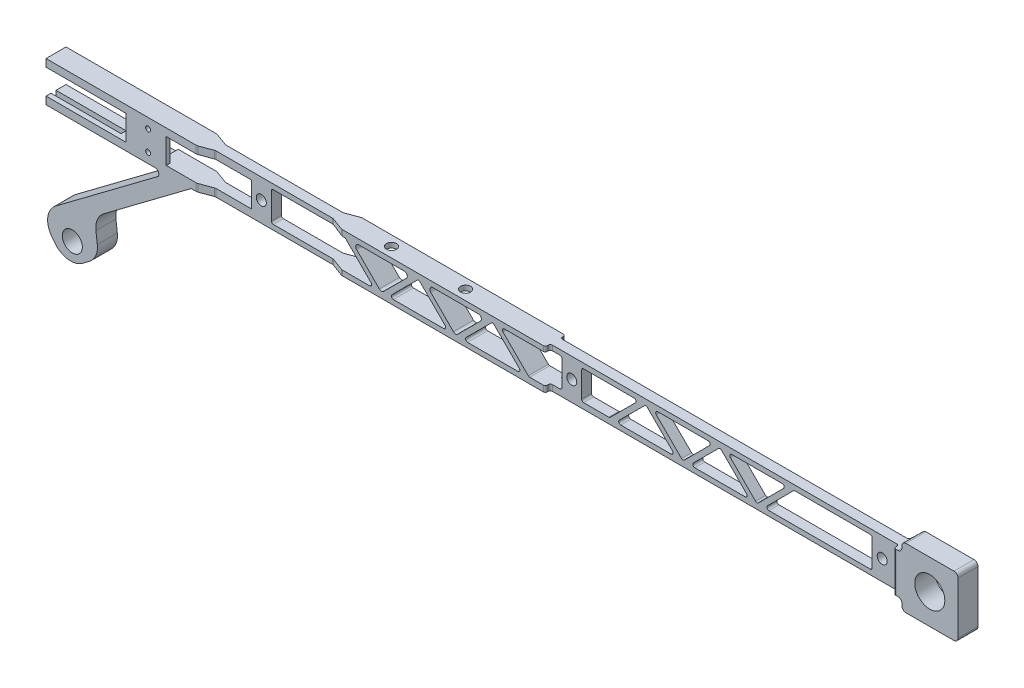
from build123d import *

# Parameters (mm, degrees)
BOSS_EXTRUDE1_DEPTH             = 12.7
CUT_EXTRUDE1_DEPTH              = 12.7
LPATTERN1_COUNT                 = 7
LPATTERN1_PITCH                 = 46.99
CUT_EXTRUDE2_DEPTH              = 12.7
LPATTERN2_COUNT                 = 8
LPATTERN2_PITCH                 = 46.99
CUT_EXTRUDE13_DEPTH             = 12.7
LPATTERN4_COUNT                 = 2
LPATTERN4_PITCH                 = 46.99
SKETCH15_W                      = 50.8
SKETCH15_H                      = 15.875
CUT_EXTRUDE6_DEPTH              = 573.205120564
SKETCH16_W                      = 3.175
SKETCH16_H                      = 22.225
CUT_EXTRUDE7_DEPTH              = 44.45
CUT_EXTRUDE8_DEPTH              = 10.16
SKETCH18_W                      = 50.8
SKETCH18_H                      = 15.875
CUT_EXTRUDE9_DEPTH              = 2.54
F_1_8_0_125_DIAMETER_HOLE1_D    = 3.175
CUT_EXTRUDE14_DEPTH             = 12.7
CUT_EXTRUDE15_START             = -12.7
CUT_EXTRUDE15_DEPTH             = 12.7
BOSS_EXTRUDE3_DEPTH             = 12.7
BOSS_EXTRUDE4_DEPTH             = 12.7
CUT_EXTRUDE10_DEPTH             = 12.7
SKETCH28_R                      = 6.35
BOSS_EXTRUDE5_DEPTH             = 12.7
CUT_EXTRUDE11_DEPTH             = 12.7
FILLET1_R                       = 12.7
F_1_4_0_25_DIAMETER_HOLE1_D     = 6.35
F_1_4_0_25_DIAMETER_HOLE2_D     = 6.35
F_1_4_0_25_DIAMETER_HOLE2_DEPTH = 3.175
F_1_4_0_25_DIAMETER_HOLE2_TIP   = 1.907732465
SKETCH14_R                      = 3.175
CUT_EXTRUDE5_DEPTH              = 577.935099022
BOSS_EXTRUDE7_START             = -12.7
SKETCH30_R                      = 3.175
BOSS_EXTRUDE7_DEPTH             = 12.7
SKETCH31_R                      = 9.525
CUT_EXTRUDE12_DEPTH             = 12.7
FILLET2_R                       = 2.54
FILLET5_R                       = 2.54
CUT_EXTRUDE16_DEPTH             = 12.7
CUT_EXTRUDE17_REACH             = 589.568
CUT_EXTRUDE18_REACH             = 589.568


with BuildPart() as part:
    # Sketch1 → Boss-Extrude1 (new body)
    with BuildSketch(Plane.XY):
        with BuildLine():
            Line((2.54, 0), (568.96, 0))
            ThreePointArc((568.96, 0), (570.756051224, 0.743948776), (571.5, 2.54))
            Line((571.5, 2.54), (571.5, 22.86))
            ThreePointArc((571.5, 22.86), (570.756051224, 24.656051224), (568.96, 25.4))
            Line((568.96, 25.4), (2.54, 25.4))
            Line((2.54, 25.4), (0, 25.4))
            Line((0, 25.4), (0, 22.86))
            Line((0, 22.86), (0, 2.54))
            Line((0, 2.54), (0, 0))
            Line((0, 0), (2.54, 0))
        make_face()
    extrude(amount=BOSS_EXTRUDE1_DEPTH)

    # Sketch2 → Cut-Extrude1 (cut)
    with BuildSketch(Plane.XY):
        with BuildLine():
            Line((173.246051224, 3.175), (205.213948776, 3.175))
            ThreePointArc((205.213948776, 3.175), (206.387275782, 3.958992041), (206.111974388, 5.343025612))
            Line((206.111974388, 5.343025612), (190.128025612, 21.326974388))
            ThreePointArc((190.128025612, 21.326974388), (189.23, 21.698948776), (188.331974388, 21.326974388))
            Line((188.331974388, 21.326974388), (172.348025612, 5.343025612))
            ThreePointArc((172.348025612, 5.343025612), (172.072724218, 3.958992041), (173.246051224, 3.175))
        make_face()
    cut_extrude1 = extrude(amount=CUT_EXTRUDE1_DEPTH, mode=Mode.SUBTRACT)

    # LPattern1: Cut-Extrude1 ×7, 1 skipped
    with Locations(*[(i * LPATTERN1_PITCH, 0, 0) for i in range(1, LPATTERN1_COUNT) if i not in (3,)]):
        add(cut_extrude1, mode=Mode.SUBTRACT)

    # Sketch3 → Cut-Extrude2 (cut)
    with BuildSketch(Plane.XY):
        with BuildLine():
            Line((149.751051224, 22.225), (181.718948776, 22.225))
            ThreePointArc((181.718948776, 22.225), (182.892275782, 21.441007959), (182.616974388, 20.056974388))
            Line((182.616974388, 20.056974388), (166.633025612, 4.073025612))
            ThreePointArc((166.633025612, 4.073025612), (165.735, 3.701051224), (164.836974388, 4.073025612))
            Line((164.836974388, 4.073025612), (148.853025612, 20.056974388))
            ThreePointArc((148.853025612, 20.056974388), (148.577724218, 21.441007959), (149.751051224, 22.225))
        make_face()
    cut_extrude2 = extrude(amount=CUT_EXTRUDE2_DEPTH, mode=Mode.SUBTRACT)

    # LPattern2: Cut-Extrude2 ×8, 2 skipped
    with Locations(*[(i * LPATTERN2_PITCH, 0, 0) for i in range(1, LPATTERN2_COUNT) if i not in (1, 2)]):
        add(cut_extrude2, mode=Mode.SUBTRACT)

    # Sketch32 → Cut-Extrude13 (cut)
    with BuildSketch(Plane.XY.offset(12.7)):
        with BuildLine():
            Line((198.274076836, 22.225), (227.175923164, 22.225))
            ThreePointArc((227.175923164, 22.225), (228.935913673, 21.049011939), (228.522961582, 18.972961582))
            Line((228.522961582, 18.972961582), (214.072038418, 4.522038418))
            ThreePointArc((214.072038418, 4.522038418), (212.725, 3.964076836), (211.377961582, 4.522038418))
            Line((211.377961582, 4.522038418), (196.927038418, 18.972961582))
            ThreePointArc((196.927038418, 18.972961582), (196.514086327, 21.049011939), (198.274076836, 22.225))
        make_face()
    cut_extrude13 = extrude(amount=-CUT_EXTRUDE13_DEPTH, mode=Mode.SUBTRACT)

    # LPattern4: Cut-Extrude13 ×2
    with Locations(*[(i * LPATTERN4_PITCH, 0, 0) for i in range(1, LPATTERN4_COUNT)]):
        add(cut_extrude13, mode=Mode.SUBTRACT)

    # Sketch15 → Cut-Extrude6 (cut, through all)
    with BuildSketch(Plane.XY.offset(12.7)):
        with Locations((25.4, 12.7)):
            Rectangle(SKETCH15_W, SKETCH15_H)
    extrude(amount=-CUT_EXTRUDE6_DEPTH, mode=Mode.SUBTRACT)

    # Sketch16 → Cut-Extrude7 (cut)
    with BuildSketch(Plane.ZY):
        with Locations((7.9375, 12.7)):
            Rectangle(SKETCH16_W, SKETCH16_H)
    extrude(amount=-CUT_EXTRUDE7_DEPTH, mode=Mode.SUBTRACT)

    # Sketch17 → Cut-Extrude8 (cut)
    with BuildSketch(Plane.XY):
        Polygon((50.8, 20.6375), (54.61, 20.6375), (55.88, 22.2885), (71.12, 22.2885), (71.12, 20.6375), (127, 20.6375), (127, 4.7625), (71.12, 4.7625), (71.12, 3.1115), (55.88, 3.1115), (54.61, 4.7625), (50.8, 4.7625), align=None)
    extrude(amount=CUT_EXTRUDE8_DEPTH, mode=Mode.SUBTRACT)

    # Sketch18 → Cut-Extrude9 (cut)
    with BuildSketch(Plane(origin=(0, 0, 10.16), x_dir=(-1, 0, 0), z_dir=(0, 0, -1))):
        with Locations((-101.6, 12.7)):
            Rectangle(SKETCH18_W, SKETCH18_H)
    extrude(amount=-CUT_EXTRUDE9_DEPTH, mode=Mode.SUBTRACT)

    # 1/8 (0.125) Diameter Hole1 (through all)
    with Locations(Plane(origin=(0, 0, 10.16), x_dir=(-1, 0, 0), z_dir=(0, 0, -1))):
        with Locations((-64.77, 19.1135), (-64.77, 6.2865)):
            Hole(F_1_8_0_125_DIAMETER_HOLE1_D / 2)

    # Sketch34 → Cut-Extrude14 (cut)
    with BuildSketch(Plane.XY.offset(12.7)):
        with BuildLine():
            Line((189.23, 21.698948776), (181.718948776, 22.225))
            Line((181.718948776, 22.225), (140.97, 22.225))
            ThreePointArc((140.97, 22.225), (140.071974388, 21.853025612), (139.7, 20.955))
            Line((139.7, 20.955), (139.7, 4.445))
            ThreePointArc((139.7, 4.445), (140.071974388, 3.546974388), (140.97, 3.175))
            Line((140.97, 3.175), (173.246051224, 3.175))
            Line((173.246051224, 3.175), (189.23, 21.698948776))
        make_face()
    extrude(amount=-CUT_EXTRUDE14_DEPTH, mode=Mode.SUBTRACT)

    # Sketch35 → Cut-Extrude15 (cut)
    with BuildSketch(Plane.XY.offset(12.7).offset(CUT_EXTRUDE15_START)):
        with BuildLine():
            Line((323.958948776, 20.955), (323.958948776, 4.971051224))
            ThreePointArc((323.958948776, 4.971051224), (323.586974388, 4.073025612), (322.688948776, 3.701051224))
            Line((322.688948776, 3.701051224), (306.705, 3.701051224))
            Line((306.705, 3.701051224), (320.148948776, 22.225))
            Line((320.148948776, 22.225), (322.688948776, 22.225))
            ThreePointArc((322.688948776, 22.225), (323.586974388, 21.853025612), (323.958948776, 20.955))
        make_face()
    cut_extrude15 = extrude(amount=CUT_EXTRUDE15_DEPTH, mode=Mode.SUBTRACT)

    # Mirror1: Cut-Extrude15 across plane
    add(cut_extrude15.mirror(Plane(origin=(330.2, 0, 0), x_dir=(0, 0, 1), z_dir=(1, 0, 0))), mode=Mode.SUBTRACT)

    # Sketch8 → Boss-Extrude3 (add)
    with BuildSketch(Plane.XY):
        Polygon((92.075, 0), (-9.525, -76.2), (-15.24, -68.58), (76.2, 0), align=None)
    extrude(amount=BOSS_EXTRUDE3_DEPTH)

    # Sketch21 → Boss-Extrude4 (add)
    with BuildSketch(Plane(origin=(0, 0, 0), x_dir=(-1, 0, 0), z_dir=(0, 0, -1))):
        with BuildLine():
            Line((-76.2, 0), (-69.85, 0))
            ThreePointArc((-69.85, 0), (-71.419048922, -1.593650359), (-71.12, -3.81))
            Line((-71.12, -3.81), (-76.2, 0))
        make_face()
    extrude(amount=-BOSS_EXTRUDE4_DEPTH)

    # Sketch26 → Cut-Extrude10 (cut)
    with BuildSketch(Plane.XY.offset(12.7)):
        Polygon((-9.525, -76.2), (1.651, -67.818), (-0.254, -65.278), (-11.43, -73.66), align=None)
    extrude(amount=-CUT_EXTRUDE10_DEPTH, mode=Mode.SUBTRACT)

    # Sketch28 → Boss-Extrude5 (add)
    with BuildSketch(Plane.XY.offset(12.7)):
        Polygon((1.651, -67.818), (13.081, -83.058), (33.401, -67.818), (30.769818102, -45.978886423), align=None)
        with Locations((16.6878, -66.7004)):
            Circle(SKETCH28_R, mode=Mode.SUBTRACT)
    extrude(amount=-BOSS_EXTRUDE5_DEPTH)

    # Sketch29 → Cut-Extrude11 (cut)
    with BuildSketch(Plane.XY.offset(12.7)):
        Polygon((-15.24, -68.58), (-11.43, -73.66), (-0.254, -65.278), (-4.064, -60.198), align=None)
    extrude(amount=-CUT_EXTRUDE11_DEPTH, mode=Mode.SUBTRACT)

    # Fillet1
    fillet1_edges = [part.edges().sort_by_distance(p)[0] for p in [
        (30.769818102, -45.978886423, 6.35),
        (33.401, -67.818, 6.35),
        (13.081, -83.058, 6.35),
        (-4.064, -60.198, 6.35),
    ]]
    fillet(fillet1_edges, radius=FILLET1_R)

    # 1/4 (0.25) Diameter Hole1 (through all)
    with Locations(Plane.XY.offset(12.7)):
        with Locations((133.35, 12.7), (330.2, 12.7), (527.05, 12.7)):
            Hole(F_1_4_0_25_DIAMETER_HOLE1_D / 2)

    # 1/4 (0.25) Diameter Hole2
    with Locations(Plane(origin=(0, 25.4, 0), x_dir=(1, 0, 0), z_dir=(0, 1, 0))):
        with Locations((212.724999945, -6.35), (259.714999945, -6.35)):
            Hole(F_1_4_0_25_DIAMETER_HOLE2_D / 2, depth=F_1_4_0_25_DIAMETER_HOLE2_DEPTH)
            with Locations((0, 0, -(F_1_4_0_25_DIAMETER_HOLE2_DEPTH + F_1_4_0_25_DIAMETER_HOLE2_TIP / 2))):  # 118° drill point
                Cone(0, F_1_4_0_25_DIAMETER_HOLE2_D / 2, F_1_4_0_25_DIAMETER_HOLE2_TIP, mode=Mode.SUBTRACT)

    # Sketch14 → Cut-Extrude5 (cut, through all)
    with BuildSketch(Plane(origin=(0, 0, 0), x_dir=(-1, 0, 0), z_dir=(0, 0, -1))):
        with Locations((-560.3875, 12.7)):
            Circle(SKETCH14_R)
    extrude(amount=-CUT_EXTRUDE5_DEPTH, mode=Mode.SUBTRACT)

    # Sketch30 → Boss-Extrude7 (add)
    with BuildSketch(Plane.XY.offset(12.7).offset(BOSS_EXTRUDE7_START)):
        Polygon((578.262851122, 12.7), (578.262851122, 31.75), (542.702851122, 31.75), (542.702851122, 25.4), (542.702851122, 0), (542.702851122, -6.35), (578.262851122, -6.35), align=None)
        with Locations(Location((560.3875, 12.7, 0), (0, 0, 180))):
            Circle(SKETCH30_R, mode=Mode.SUBTRACT)
    extrude(amount=BOSS_EXTRUDE7_DEPTH)

    # Sketch31 → Cut-Extrude12 (cut)
    with BuildSketch(Plane.XY.offset(12.7)):
        with Locations((560.3875, 12.7)):
            Circle(SKETCH31_R)
    extrude(amount=-CUT_EXTRUDE12_DEPTH, mode=Mode.SUBTRACT)

    # Fillet2
    fillet2_edges = [part.edges().sort_by_distance(p)[0] for p in [
        (578.262851122, 31.75, 6.35),
        (578.262851122, -6.35, 6.35),
    ]]
    fillet(fillet2_edges, radius=FILLET2_R)

    # Fillet5
    fillet5_edges = [part.edges().sort_by_distance(p)[0] for p in [
        (542.702851122, 25.4, 6.35),
        (542.702851122, -6.35, 6.35),
        (542.702851122, 31.75, 6.35),
        (542.702851122, 0, 6.35),
    ]]
    fillet(fillet5_edges, radius=FILLET5_R)

    # Sketch36 → Cut-Extrude16 (cut)
    with BuildSketch(Plane.XY.offset(12.7)):
        with BuildLine():
            Line((471.696051224, 22.225), (519.43, 22.225))
            ThreePointArc((519.43, 22.225), (520.328025612, 21.853025612), (520.7, 20.955))
            Line((520.7, 20.955), (520.7, 4.445))
            ThreePointArc((520.7, 4.445), (520.328025612, 3.546974388), (519.43, 3.175))
            Line((519.43, 3.175), (487.153948776, 3.175))
            Line((487.153948776, 3.175), (470.271974388, 21.326974388))
            Line((470.271974388, 21.326974388), (470.798025612, 21.853025612))
            ThreePointArc((470.798025612, 21.853025612), (471.210043265, 22.128327006), (471.696051224, 22.225))
        make_face()
    extrude(amount=-CUT_EXTRUDE16_DEPTH, mode=Mode.SUBTRACT)

    # Cut-Extrude17: up to this face of the body (flat: up to its plane)
    cut_extrude17_end = Plane(part.part.faces().sort_by_distance((34.925, 0, 6.35))[0])
    # Sketch37 → Cut-Extrude17 (cut, up to the picked face)
    with BuildSketch(Plane(origin=(0, 25.4, 0), x_dir=(1, 0, 0), z_dir=(0, 1, 0)), mode=Mode.PRIVATE) as cut_extrude17_sk1:
        with BuildLine():
            Line((187.082019849, -0.156567422), (179.312980151, -3.018432578))
            ThreePointArc((179.312980151, -3.018432578), (178.880915492, -3.135551814), (178.435, -3.175))
            Line((178.435, -3.175), (104.775, -3.175))
            ThreePointArc((104.775, -3.175), (104.329084508, -3.135551814), (103.897019849, -3.018432578))
            Line((103.897019849, -3.018432578), (96.127980151, -0.156567422))
            ThreePointArc((96.127980151, -0.156567422), (95.695915492, -0.039448186), (95.25, 0))
            Line((95.25, 0), (187.96, 0))
            ThreePointArc((187.96, 0), (187.514084508, -0.039448186), (187.082019849, -0.156567422))
        make_face()
    cut_extrude17_tool1 = split(extrude(cut_extrude17_sk1.sketch, amount=-CUT_EXTRUDE17_REACH, mode=Mode.PRIVATE), bisect_by=cut_extrude17_end, keep=Keep.BOTH, mode=Mode.PRIVATE)
    cut_extrude17 = cut_extrude17_tool1.solids().sort_by(Axis((141.605, 25.4, 1.532389), (0, -1, 0)))[0]
    add(cut_extrude17, mode=Mode.SUBTRACT)

    # Cut-Extrude18: up to this face of the body (flat: up to its plane)
    cut_extrude18_end = Plane(part.part.faces().sort_by_distance((34.925, 0, 6.35))[0])
    # Sketch38 → Cut-Extrude18 (cut, up to the picked face)
    with BuildSketch(Plane(origin=(0, 25.4, 0), x_dir=(1, 0, 0), z_dir=(0, 1, 0)), mode=Mode.PRIVATE) as cut_extrude18_sk1:
        with BuildLine():
            Line((537.622851122, -1.27), (537.622851122, -1.905))
            ThreePointArc((537.622851122, -1.905), (537.250876734, -2.803025612), (536.352851122, -3.175))
            Line((536.352851122, -3.175), (317.912851122, -3.175))
            ThreePointArc((317.912851122, -3.175), (317.01482551, -2.803025612), (316.642851122, -1.905))
            Line((316.642851122, -1.905), (316.642851122, -1.27))
            ThreePointArc((316.642851122, -1.27), (316.270876734, -0.371974388), (315.372851122, 0))
            Line((315.372851122, 0), (537.622851122, 0))
            Line((537.622851122, 0), (538.892851122, 0))
            ThreePointArc((538.892851122, 0), (537.99482551, -0.371974388), (537.622851122, -1.27))
        make_face()
    cut_extrude18_tool1 = split(extrude(cut_extrude18_sk1.sketch, amount=-CUT_EXTRUDE18_REACH, mode=Mode.PRIVATE), bisect_by=cut_extrude18_end, keep=Keep.BOTH, mode=Mode.PRIVATE)
    cut_extrude18 = cut_extrude18_tool1.solids().sort_by(Axis((427.132851, 25.4, 1.584927), (0, -1, 0)))[0]
    add(cut_extrude18, mode=Mode.SUBTRACT)

    # Mirror2: Cut-Extrude17, Cut-Extrude18 across plane
    add(cut_extrude17.mirror(Plane.XY.offset(6.35)), mode=Mode.SUBTRACT)
    add(cut_extrude18.mirror(Plane.XY.offset(6.35)), mode=Mode.SUBTRACT)


solid = part.part
